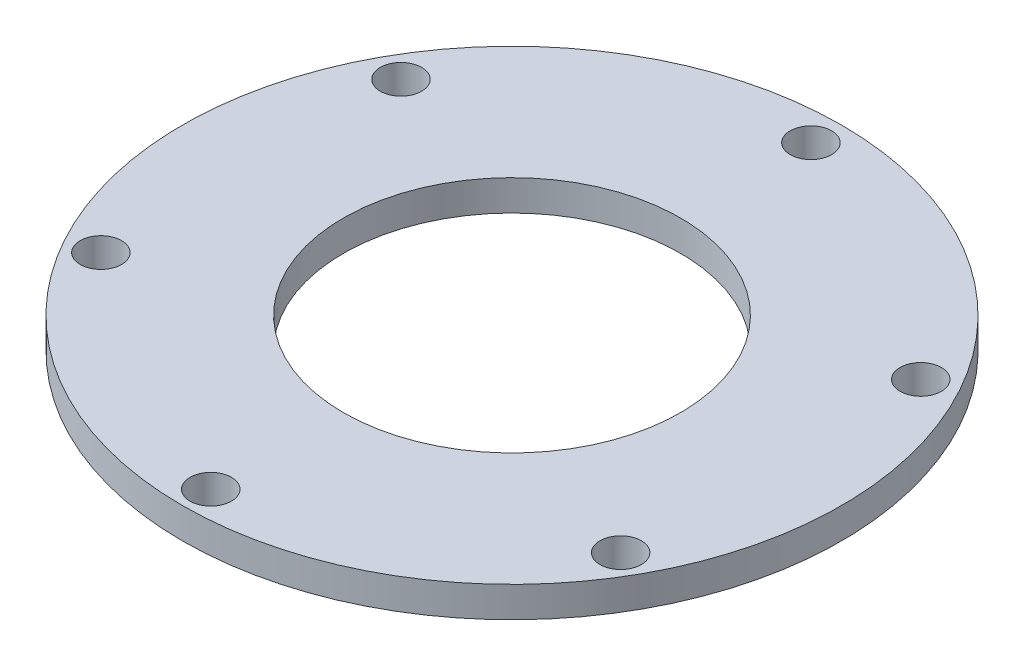
from build123d import *

# Parameters (mm, degrees)
CROQUIS1_R              = 107.5
SALIENTE_EXTRUIR1_DEPTH = 10
MATRIZC1_COUNT          = 6
CROQUIS4_R              = 55
CORTAR_EXTRUIR1_DEPTH   = 10


with BuildPart() as part:
    # Croquis1 → Saliente-Extruir1 (new body)
    with BuildSketch(Plane(origin=(0, 0, 0), x_dir=(1, 0, 0), z_dir=(0, 1, 0))):
        with Locations(Location((0, 0, 0), (0, 0, 270))):
            Circle(CROQUIS1_R)
    extrude(amount=SALIENTE_EXTRUIR1_DEPTH)

    # Croquis6 → Taladro de margen para M121 (revolve, cut)
    with BuildSketch(Plane(origin=(0, 10, -97.5), x_dir=(0, 0, 1), z_dir=(1, 0, 0))):
        Polygon((0, 0), (0, 47.555809178), (6.75, 43.5), (6.75, 0), align=None)
    taladro_de_margen_para_m121 = revolve(axis=Axis((0, 16.35, -97.5), (0, -1, 0)), mode=Mode.SUBTRACT)

    # MatrizC1: Taladro de margen para M121 ×6 about axis
    matrizc1_axis = Axis((0, 0, 0.385932096), (0, 1, 0))
    for i in range(1, MATRIZC1_COUNT):
        add(taladro_de_margen_para_m121.rotate(matrizc1_axis, i * 360 / MATRIZC1_COUNT), mode=Mode.SUBTRACT)

    # Croquis4 → Cortar-Extruir1 (cut)
    with BuildSketch(Plane(origin=(0, 10, 0), x_dir=(1, 0, 0), z_dir=(0, 1, 0))):
        with Locations(Location((0, 0, 0), (0, 0, 270))):
            Circle(CROQUIS4_R)
    extrude(amount=-CORTAR_EXTRUIR1_DEPTH, mode=Mode.SUBTRACT)


solid = part.part
